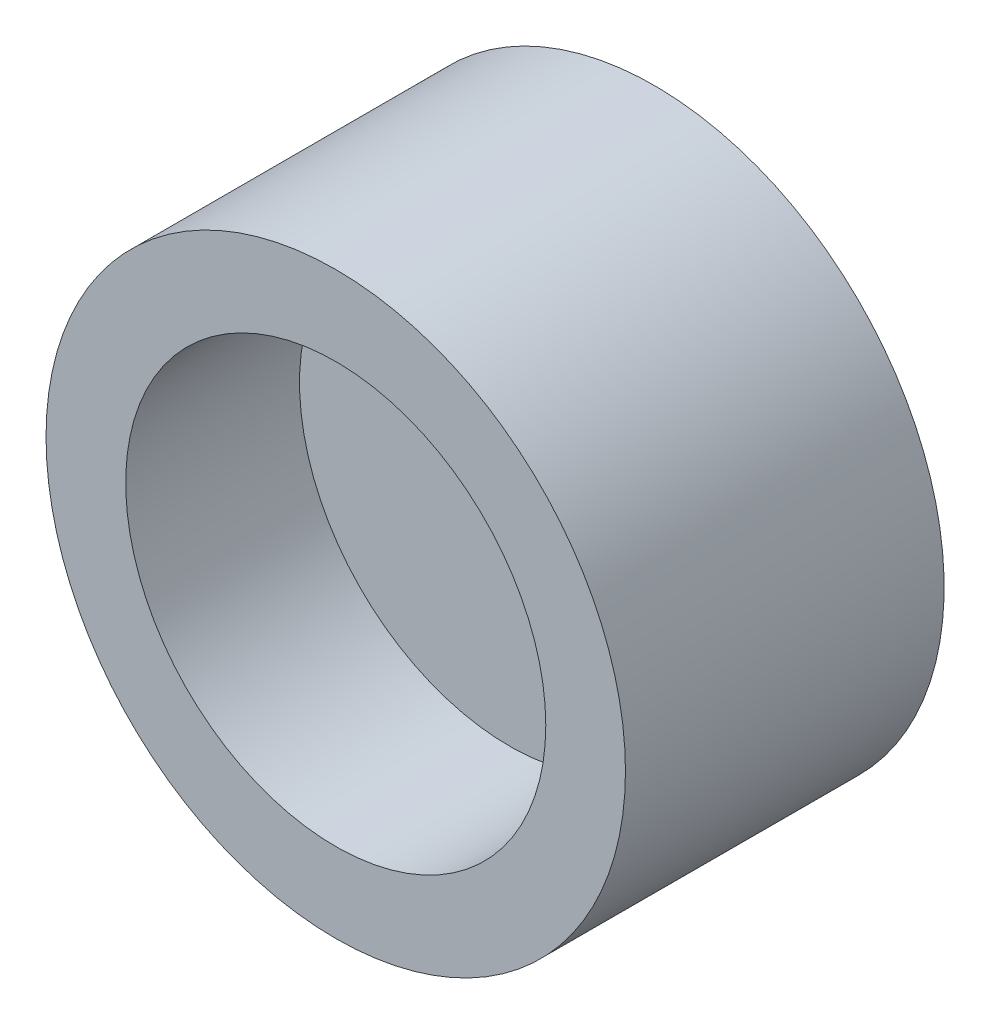
from build123d import *

# Parameters (mm, degrees)
SKETCH1_R           = 2
SKETCH1_R_2         = 1.45
BOSS_EXTRUDE1_DEPTH = 1.2
BOSS_EXTRUDE2_START = 1
SKETCH2_R           = 2
BOSS_EXTRUDE2_DEPTH = 1


with BuildPart() as part:
    # Sketch1 → Boss-Extrude1 (new body)
    with BuildSketch(Plane.XY):
        Circle(SKETCH1_R)
        Circle(SKETCH1_R_2, mode=Mode.SUBTRACT)
    extrude(amount=BOSS_EXTRUDE1_DEPTH)

    # Sketch2 → Boss-Extrude2 (add)
    with BuildSketch(Plane(origin=(0, 0, 0), x_dir=(-1, 0, 0), z_dir=(0, 0, -1)).offset(BOSS_EXTRUDE2_START)):
        Circle(SKETCH2_R)
    extrude(amount=-BOSS_EXTRUDE2_DEPTH)


solid = part.part
